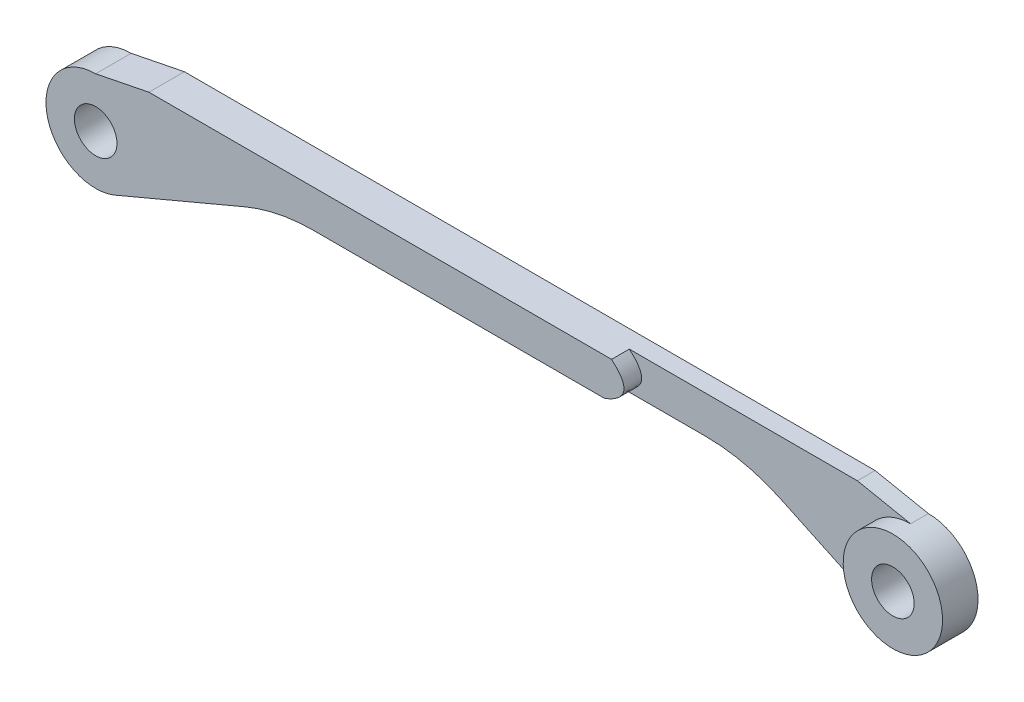
from build123d import *

# Parameters (mm, degrees)
SKETCH_1_R          = 6
EXTRUDE_1_DEPTH     = 10
FILLET_1_R          = 50
CUT_EXTRUDE_START   = -10
CUT_EXTRUDE_1_DEPTH = 5
SKETCH_3_R          = 6
EXTRUDE_2_DEPTH     = 5


with BuildPart() as part:
    # 草图1 → 凸台-拉伸1 (new body)
    with BuildSketch(Plane.XY):
        with BuildLine():
            ThreePointArc((-224.65, 14), (-238.371758065, -2.777292857), (-219.205808477, -12.898092055))
            Line((-219.205808477, -12.898092055), (-173.31881601, 6.470476128))
            Line((-173.31881601, 6.470476128), (-46.68118399, 6.470476128))
            Line((-46.68118399, 6.470476128), (-5.954935625, -12.67038838))
            ThreePointArc((-5.954935625, -12.67038838), (13.663554393, -3.050783725), (0, 14))
            Line((0, 14), (-15, 17))
            Line((-15, 17), (-209.65, 17))
            Line((-209.65, 17), (-224.65, 14))
        make_face()
        Circle(SKETCH_1_R, mode=Mode.SUBTRACT)
        with Locations((-224.65, 0)):
            Circle(SKETCH_1_R, mode=Mode.SUBTRACT)
    extrude(amount=EXTRUDE_1_DEPTH)

    # 圆角1
    fillet_1_edges = [part.edges().sort_by_distance(p)[0] for p in [
        (-46.68118399, 6.470476128, 5),
        (-173.31881601, 6.470476128, 5),
    ]]
    fillet(fillet_1_edges, radius=FILLET_1_R)

    # 草图2 → 切除-拉伸1 (cut)
    with BuildSketch(Plane(origin=(0, 0, 0), x_dir=(-1, 0, 0), z_dir=(0, 0, -1)).offset(CUT_EXTRUDE_START)):
        with BuildLine():
            ThreePointArc((0, 14), (-13.663554393, -3.050783725), (5.954935625, -12.67038838))
            Line((5.954935625, -12.67038838), (36.577502967, 1.7218632))
            ThreePointArc((36.577502967, 1.7218632), (46.949474036, 5.268884675), (57.845130198, 6.470476128))
            Line((57.845130198, 6.470476128), (81.273241992, 6.470476128))
            add(Edge.make_bspline(
                [(79.271606959, 17), (71.403494621, 10.255908375), (81.273241992, 6.470476128)],
                knots=[0, 0, 0, 1, 1, 1], degree=2))
            Line((79.271606959, 17), (15, 17))
            Line((15, 17), (0, 14))
        make_face()
    extrude(amount=CUT_EXTRUDE_1_DEPTH, mode=Mode.SUBTRACT)

    # 草图3 → 凸台-拉伸2 (add)
    with BuildSketch(Plane.XY.offset(5)):
        with BuildLine():
            ThreePointArc((14, 0), (9.899494937, 9.899494937), (0, 14))
            ThreePointArc((0, 14), (-13.663554393, 3.050783725), (-5.954935625, -12.67038838))
            ThreePointArc((-5.954935625, -12.67038838), (7.504362107, -11.818821827), (14, 0))
        make_face()
        Circle(SKETCH_3_R, mode=Mode.SUBTRACT)
    extrude(amount=EXTRUDE_2_DEPTH)


solid = part.part
